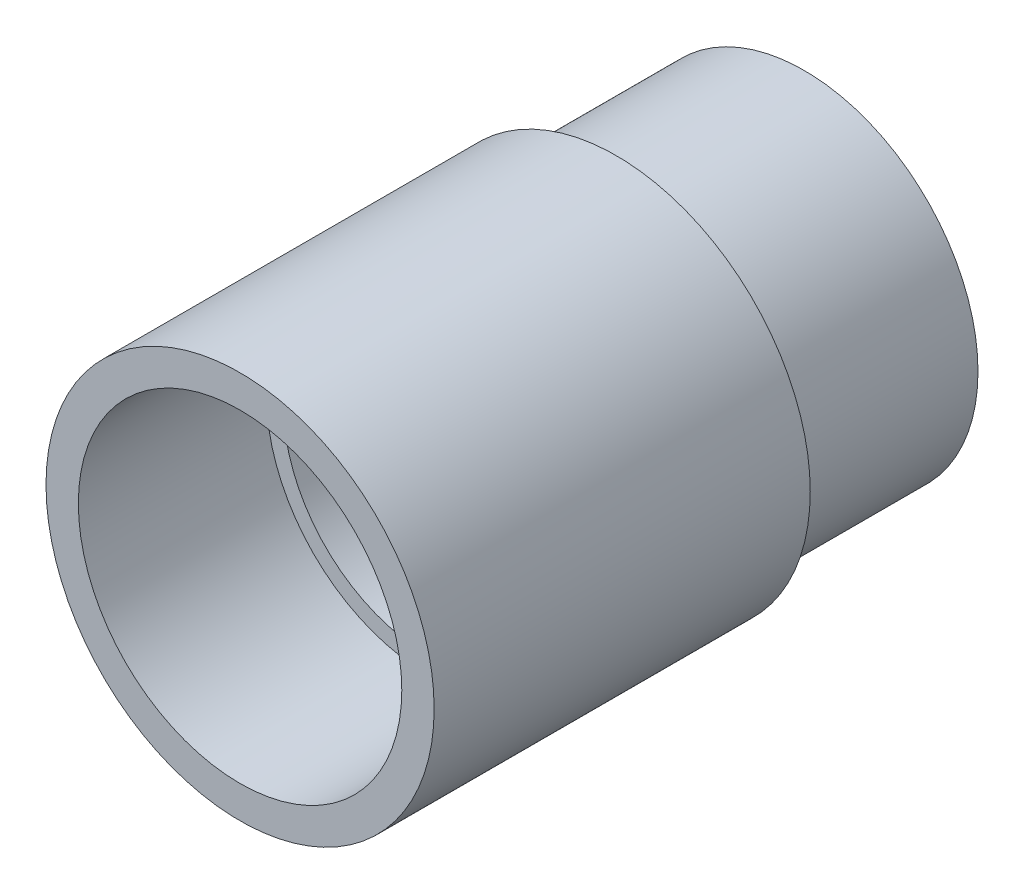
from build123d import *

# Parameters (mm, degrees)
SKETCH4_R           = 18.48
SKETCH4_R_2         = 15.4
BOSS_EXTRUDE1_DEPTH = 40
SKETCH5_R           = 20.64
SKETCH5_R_2         = 17.2
BOSS_EXTRUDE2_DEPTH = 40


with BuildPart() as part:
    # Sketch4 → Boss-Extrude1 (new body)
    with BuildSketch(Plane.XY):
        Circle(SKETCH4_R)
        Circle(SKETCH4_R_2, mode=Mode.SUBTRACT)
    extrude(amount=BOSS_EXTRUDE1_DEPTH)

    # Sketch5 → Boss-Extrude2 (add)
    with BuildSketch(Plane.XY.offset(20)):
        Circle(SKETCH5_R)
        Circle(SKETCH5_R_2, mode=Mode.SUBTRACT)
    extrude(amount=BOSS_EXTRUDE2_DEPTH)


solid = part.part
